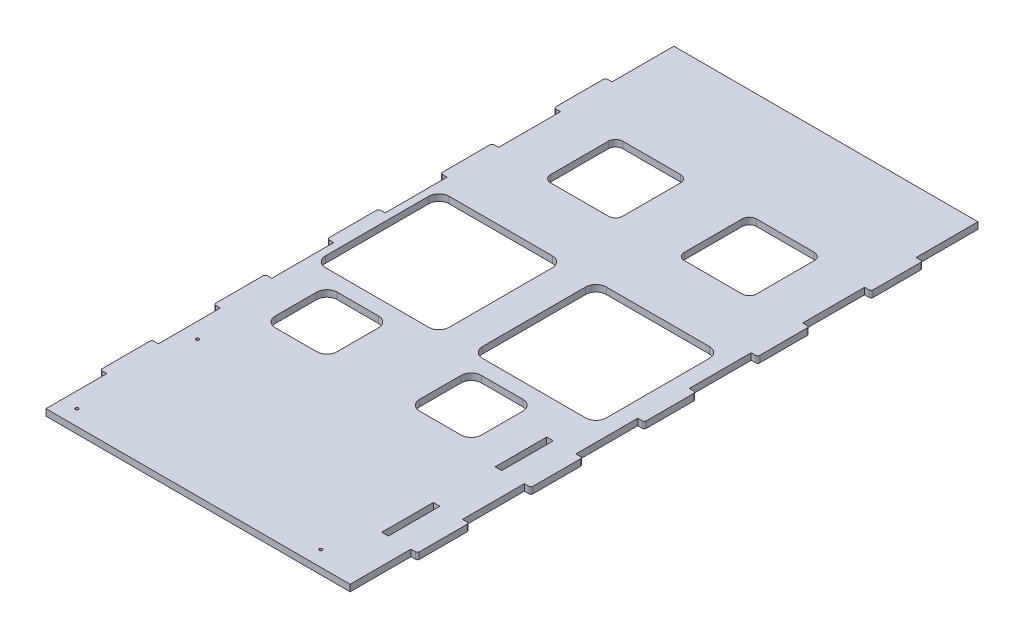
from build123d import *

# Parameters (mm, degrees)
BOSS_EXTRUDE1_DEPTH = 6.35
FILLET1_R           = 2
SKETCH2_R           = 1.5
SKETCH2_W           = 6.35
SKETCH2_H           = 50
SKETCH2_W_2         = 120
SKETCH2_H_2         = 120
CUT_EXTRUDE1_DEPTH  = 6.35
FILLET2_R           = 10


with BuildPart() as part:
    # Sketch1 → Boss-Extrude1 (new body)
    with BuildSketch(Plane(origin=(0, 0, 0), x_dir=(1, 0, 0), z_dir=(0, 1, 0))):
        Polygon((0, 0), (295, 0), (295, 59), (301.35, 59), (301.35, 109), (295, 109), (295, 169), (301.35, 169), (301.35, 219), (295, 219), (295, 279), (301.35, 279), (301.35, 329), (295, 329), (295, 389), (301.35, 389), (301.35, 439), (295, 439), (295, 499), (301.35, 499), (301.35, 549), (295, 549), (295, 609), (0, 609), (0, 549), (-6.35, 549), (-6.35, 499), (0, 499), (0, 439), (-6.35, 439), (-6.35, 389), (0, 389), (0, 329), (-6.35, 329), (-6.35, 279), (0, 279), (0, 219), (-6.35, 219), (-6.35, 169), (0, 169), (0, 109), (-6.35, 109), (-6.35, 59), (0, 59), align=None)
    extrude(amount=BOSS_EXTRUDE1_DEPTH)

    # Fillet1
    fillet1_edges = [part.edges().sort_by_distance(p)[0] for p in [
        (-6.35, 3.175, -59),
        (-6.35, 3.175, -109),
        (-6.35, 3.175, -169),
        (-6.35, 3.175, -219),
        (-6.35, 3.175, -279),
        (-6.35, 3.175, -329),
        (-6.35, 3.175, -389),
        (-6.35, 3.175, -439),
        (-6.35, 3.175, -499),
        (-6.35, 3.175, -549),
        (301.35, 3.175, -549),
        (301.35, 3.175, -499),
        (301.35, 3.175, -439),
        (301.35, 3.175, -389),
        (301.35, 3.175, -329),
        (301.35, 3.175, -279),
        (301.35, 3.175, -219),
        (301.35, 3.175, -169),
        (301.35, 3.175, -109),
        (301.35, 3.175, -59),
    ]]
    fillet(fillet1_edges, radius=FILLET1_R)

    # Sketch2 → Cut-Extrude1 (cut)
    with BuildSketch(Plane(origin=(0, 6.35, 0), x_dir=(1, 0, 0), z_dir=(0, 1, 0))):
        with Locations(Location((15, 15, 0), (0, 0, 270))):
            Circle(SKETCH2_R)
        with Locations(Location((251.65, 15, 0), (0, 0, 270))):
            Circle(SKETCH2_R)
        with Locations(Location((15, 131.925897501, 0), (0, 0, 270))):
            Circle(SKETCH2_R)
        with Locations((269.825, 194)):
            Rectangle(SKETCH2_W, SKETCH2_H)
        with Locations((269.825, 84)):
            Rectangle(SKETCH2_W, SKETCH2_H)
        with BuildLine():
            Line((55.042435698, 504.435466218), (111.042435698, 504.435466218))
            ThreePointArc((111.042435698, 504.435466218), (115.992183166, 502.385213686), (118.042435698, 497.435466218))
            Line((118.042435698, 497.435466218), (118.042435698, 441.435466218))
            ThreePointArc((118.042435698, 441.435466218), (115.992183166, 436.48571875), (111.042435698, 434.435466218))
            Line((111.042435698, 434.435466218), (55.042435698, 434.435466218))
            ThreePointArc((55.042435698, 434.435466218), (50.09268823, 436.48571875), (48.042435698, 441.435466218))
            Line((48.042435698, 441.435466218), (48.042435698, 497.435466218))
            ThreePointArc((48.042435698, 497.435466218), (50.09268823, 502.385213686), (55.042435698, 504.435466218))
        make_face()
        with BuildLine():
            Line((185.233522799, 503.969461472), (241.233522799, 503.969461472))
            ThreePointArc((241.233522799, 503.969461472), (246.183270267, 501.91920894), (248.233522799, 496.969461472))
            Line((248.233522799, 496.969461472), (248.233522799, 440.969461472))
            ThreePointArc((248.233522799, 440.969461472), (246.183270267, 436.019714004), (241.233522799, 433.969461472))
            Line((241.233522799, 433.969461472), (185.233522799, 433.969461472))
            ThreePointArc((185.233522799, 433.969461472), (180.283775331, 436.019714004), (178.233522799, 440.969461472))
            Line((178.233522799, 440.969461472), (178.233522799, 496.969461472))
            ThreePointArc((178.233522799, 496.969461472), (180.283775331, 501.91920894), (185.233522799, 503.969461472))
        make_face()
        with BuildLine():
            Line((43.325, 239.143159068), (83.325, 239.143159068))
            ThreePointArc((83.325, 239.143159068), (90.396067812, 236.21422688), (93.325, 229.143159068))
            Line((93.325, 229.143159068), (93.325, 189.143159068))
            ThreePointArc((93.325, 189.143159068), (90.396067812, 182.072091256), (83.325, 179.143159068))
            Line((83.325, 179.143159068), (43.325, 179.143159068))
            ThreePointArc((43.325, 179.143159068), (36.253932188, 182.072091256), (33.325, 189.143159068))
            Line((33.325, 189.143159068), (33.325, 229.143159068))
            ThreePointArc((33.325, 229.143159068), (36.253932188, 236.21422688), (43.325, 239.143159068))
        make_face()
        with Locations((67.172717051, 313.959589149)):
            Rectangle(SKETCH2_W_2, SKETCH2_H_2)
        with Locations((219.464803824, 313.959589149)):
            Rectangle(SKETCH2_W_2, SKETCH2_H_2)
        with BuildLine():
            Line((173.325, 229.143159068), (173.325, 189.143159068))
            ThreePointArc((173.325, 189.143159068), (176.253932188, 182.072091256), (183.325, 179.143159068))
            Line((183.325, 179.143159068), (223.325, 179.143159068))
            ThreePointArc((223.325, 179.143159068), (230.396067812, 182.072091256), (233.325, 189.143159068))
            Line((233.325, 189.143159068), (233.325, 229.143159068))
            ThreePointArc((233.325, 229.143159068), (230.396067812, 236.21422688), (223.325, 239.143159068))
            Line((223.325, 239.143159068), (183.325, 239.143159068))
            ThreePointArc((183.325, 239.143159068), (176.253932188, 236.21422688), (173.325, 229.143159068))
        make_face()
    extrude(amount=-CUT_EXTRUDE1_DEPTH, mode=Mode.SUBTRACT)

    # Fillet2
    fillet2_edges = [part.edges().sort_by_distance(p)[0] for p in [
        (7.172717051, 3.175, -253.959589149),
        (7.172717051, 3.175, -373.959589149),
        (127.172717051, 3.175, -373.959589149),
        (127.172717051, 3.175, -253.959589149),
        (159.464803824, 3.175, -253.959589149),
        (159.464803824, 3.175, -373.959589149),
        (279.464803824, 3.175, -373.959589149),
        (279.464803824, 3.175, -253.959589149),
    ]]
    fillet(fillet2_edges, radius=FILLET2_R)


solid = part.part
